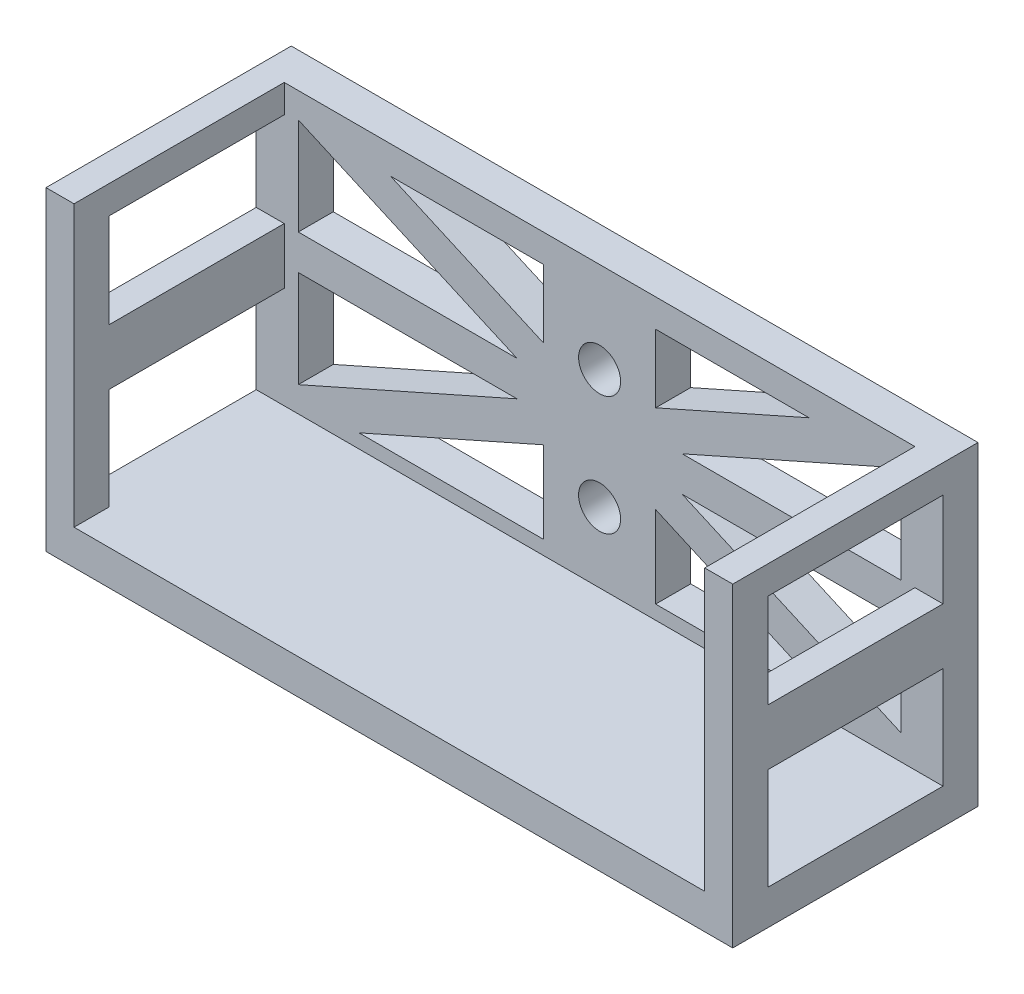
from build123d import *

# Parameters (mm, degrees)
SKETCH1_W               = 90
SKETCH1_H               = 40
BOSS_EXTRUDE1_DEPTH     = 5
BOSS_EXTRUDE2_DEPTH     = 35
SKETCH3_R               = 3
CUT_EXTRUDE1_DEPTH      = 63.646443504
CUT_EXTRUDE2_DEPTH      = 35
CUT_EXTRUDE3_DEPTH      = 108.016713105
CUT_EXTRUDE3_DEPTH_BACK = 108.016713105
SKETCH5_W               = 25
SKETCH5_H               = 13.442792372
SKETCH5_H_2             = 14.528729082


with BuildPart() as part:
    # Sketch1 → Boss-Extrude1 (new body)
    with BuildSketch(Plane.XY):
        Rectangle(SKETCH1_W, SKETCH1_H)
    extrude(amount=BOSS_EXTRUDE1_DEPTH)

    # Sketch2 → Boss-Extrude2 (add)
    with BuildSketch(Plane.XY):
        Polygon((-45, 20), (-49, 20), (-49, -19.971521454), (-49, -24.971521454), (49, -24.971521454), (49, -19.971521454), (49, 20), (45, 20), (45, -19.971521454), (-45, -19.971521454), align=None)
    extrude(amount=BOSS_EXTRUDE2_DEPTH)

    # Sketch3 → Cut-Extrude1 (cut, through all)
    with BuildSketch(Plane.XY.offset(5)):
        with Locations((0, 7.028478546)):
            Circle(SKETCH3_R)
        with Locations((0, -9.971521454)):
            Circle(SKETCH3_R)
    extrude(amount=-CUT_EXTRUDE1_DEPTH, mode=Mode.SUBTRACT)

    # Sketch4 → Cut-Extrude2 (cut)
    with BuildSketch(Plane.XY.offset(5)):
        Polygon((-29.844463874, 16), (-8, 16), (-8, 6.291349389), align=None)
        Polygon((-43, 16.375317277), (-11.788929697, 2.503730476), (-43, 2.513606541), align=None)
        Polygon((-43, -2.486393709), (-11.787483748, -2.496270232), (-43, -16.348746631), align=None)
        Polygon((-8, -6.28564435), (-8, -17.971521454), (-34.330716509, -17.971521454), align=None)
        Polygon((8, -6.291349389), (8, -17.971521454), (34.280387146, -17.971521454), align=None)
        Polygon((43, -2.512973685), (43, -16.375317277), (11.788929697, -2.503730476), align=None)
        Polygon((11.787483748, 2.496270232), (43, 16.348746631), (43, 2.486393709), align=None)
        Polygon((8, 16), (29.888467798, 16), (8, 6.28564435), align=None)
    extrude(amount=-CUT_EXTRUDE2_DEPTH, mode=Mode.SUBTRACT)

    # Sketch5 → Cut-Extrude3 (cut, two sides: drawn at the far end of the back side and taken through both)
    with BuildSketch(Plane(origin=(49, 0, 0), x_dir=(0, 0, -1), z_dir=(1, 0, 0)).offset(-CUT_EXTRUDE3_DEPTH_BACK)):
        with Locations((-17.5, 9.278603814)):
            Rectangle(SKETCH5_W, SKETCH5_H)
        with Locations((-17.5, -12.707156913)):
            Rectangle(SKETCH5_W, SKETCH5_H_2)
    extrude(amount=CUT_EXTRUDE3_DEPTH + CUT_EXTRUDE3_DEPTH_BACK, mode=Mode.SUBTRACT)


solid = part.part
